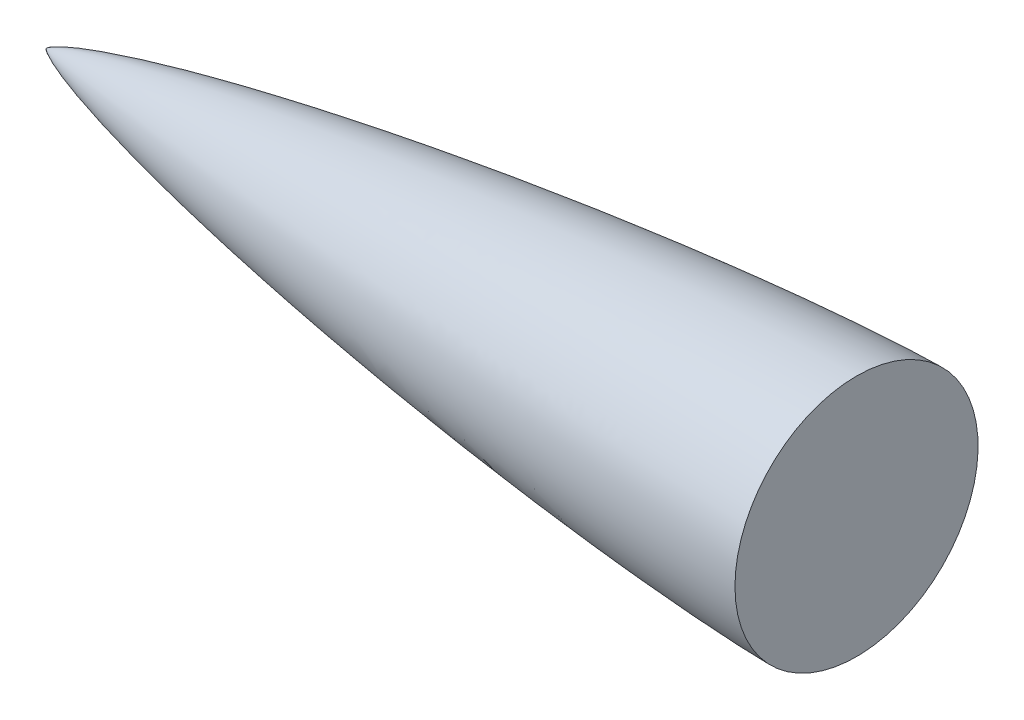
from build123d import *


with BuildPart() as part:
    # Sketch8 → Revolve8 (revolve)
    with BuildSketch(Plane.XY):
        with BuildLine():
            Line((0, 0), (20, 0))
            Line((20, 0), (20, 3))
            add(Edge.make_bspline(
                [(0, 0), (0.001521911, 0.003276425), (0.005169377, 0.008724741), (0.01224732, 0.015389267), (0.022790975, 0.024496849), (0.036400332, 0.034657724), (0.057316791, 0.048792256), (0.092657391, 0.069992115), (0.154805145, 0.102946824), (0.268152702, 0.15553451), (0.471720748, 0.237309671), (0.810826929, 0.354992151), (1.414267882, 0.536771085), (2.272167797, 0.758399734), (3.342153059, 1.001184112), (4.572855693, 1.250046782), (5.819644191, 1.479233172), (7.382140386, 1.742934527), (8.948874408, 1.980374241), (10.518866859, 2.195089323), (12.091643197, 2.388034948), (13.351390948, 2.529414324), (14.612570362, 2.657374986), (15.875115255, 2.771196297), (17.138990727, 2.869118068), (18.32813594, 2.943913568), (19.201836212, 2.982990218), (19.759290584, 2.998309412), (20, 3)],
                knots=[0, 0, 0, 0, 0, 0.000709365, 0.001298875, 0.001888194, 0.002756681, 0.004048247, 0.006274892, 0.010002863, 0.016613316, 0.028658082, 0.04948617, 0.080709186, 0.140768354, 0.203214532, 0.265660702, 0.328106876, 0.390553052, 0.515445401, 0.577891576, 0.640337751, 0.702783926, 0.7652301, 0.827676277, 0.890122452, 0.952568627, 1, 1, 1, 1, 1], degree=4))
        make_face()
    revolve(axis=Axis((0, 0, 0), (1, 0, 0)))


solid = part.part
